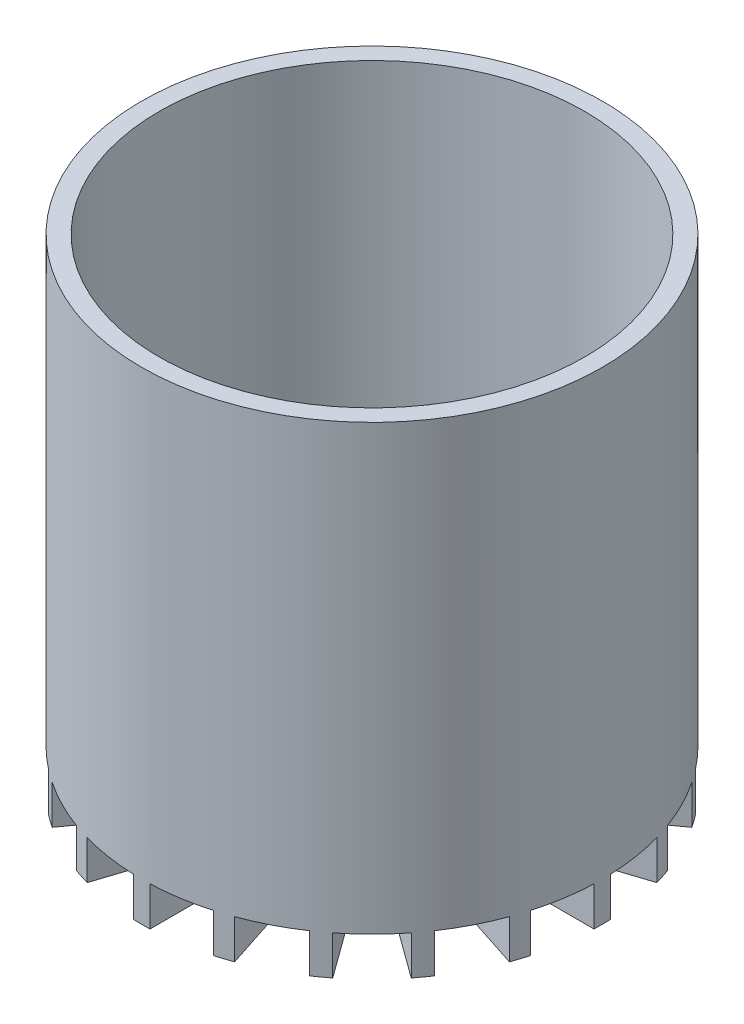
from build123d import *
from build123d.topology import SkipClean

# Parameters (mm, degrees)
SKETCH1_R               = 38.1
BOSS_EXTRUDE1_DEPTH     = 76.2
SHELL2_T                = 3.175
SKETCH2_W               = 3
SKETCH2_H               = 82.55
SKETCH2_W_2             = 82.55
SKETCH2_H_2             = 3
BOSS_EXTRUDE2_DEPTH     = 7
CUT_EXTRUDE1_DEPTH      = 99.527366122
CUT_EXTRUDE1_DEPTH_BACK = 99.527366122
SKETCH3_R               = 61.906276858
SKETCH3_R_2             = 41.275
SKETCH4_R               = 20.64
CUT_EXTRUDE2_DEPTH      = 7
SCALE1_SCALE            = 0.615384615


with BuildPart() as part:
    # Sketch1 → Boss-Extrude1 (new body)
    with BuildSketch(Plane(origin=(0, 0, 0), x_dir=(1, 0, 0), z_dir=(0, 1, 0))):
        with Locations(Location((0, 0, 0), (0, 0, 90))):
            Circle(SKETCH1_R)
    extrude(amount=BOSS_EXTRUDE1_DEPTH)

    # Shell2
    shell2_openings = [part.faces().sort_by_distance(p)[0] for p in [
        (0, 76.2, 0),
    ]]
    offset(amount=SHELL2_T, openings=shell2_openings, kind=Kind.INTERSECTION)

    # Sketch2 → Boss-Extrude2 (add)
    with BuildSketch(Plane(origin=(0, -3.175, 0), x_dir=(-1, 0, 0), z_dir=(0, -1, 0))):
        Rectangle(SKETCH2_W, SKETCH2_H)
        Polygon((-23.047310797, -34.273854321), (25.47436178, 32.510498564), (23.047310797, 34.273854321), (-25.47436178, -32.510498564), align=None)
        Polygon((-38.791332219, -14.181261217), (39.718383202, 11.328091668), (38.791332219, 14.181261217), (-39.718383202, -11.328091668), align=None)
        Polygon((-39.718383202, 11.328091668), (38.791332219, -14.181261217), (39.718383202, -11.328091668), (-38.791332219, 14.181261217), align=None)
        Polygon((-25.47436178, 32.510498564), (23.047310797, -34.273854321), (25.47436178, -32.510498564), (-23.047310797, 34.273854321), align=None)
        Polygon((-14.181261217, 38.791332219), (11.328091668, -39.718383202), (14.181261217, -38.791332219), (-11.328091668, 39.718383202), align=None)
        Polygon((11.328091668, 39.718383202), (-14.181261217, -38.791332219), (-11.328091668, -39.718383202), (14.181261217, 38.791332219), align=None)
        Polygon((32.510498564, 25.47436178), (-34.273854321, -23.047310797), (-32.510498564, -25.47436178), (34.273854321, 23.047310797), align=None)
        Rectangle(SKETCH2_W_2, SKETCH2_H_2)
        Polygon((-34.273854321, 23.047310797), (32.510498564, -25.47436178), (34.273854321, -23.047310797), (-32.510498564, 25.47436178), align=None)
    extrude(amount=BOSS_EXTRUDE2_DEPTH)

    # Sketch3 → Cut-Extrude1 (cut, two sides: drawn at the far end of the back side and taken through both)
    with SkipClean():  # the faces are left unmerged after this step: merging them gives an invalid solid
        with BuildSketch(Plane.XZ.offset(3.175).offset(-CUT_EXTRUDE1_DEPTH_BACK)):
            Circle(SKETCH3_R)
            with Locations(Location((0, 0, 0), (0, 0, 272.082679548))):
                Circle(SKETCH3_R_2, mode=Mode.SUBTRACT)
        extrude(amount=CUT_EXTRUDE1_DEPTH + CUT_EXTRUDE1_DEPTH_BACK, mode=Mode.SUBTRACT)

    # Sketch4 → Cut-Extrude2 (cut)
    with SkipClean():  # the faces are left unmerged after this step: merging them gives an invalid solid
        with BuildSketch(Plane.XZ.offset(10.175)):
            Circle(SKETCH4_R)
        extrude(amount=-CUT_EXTRUDE2_DEPTH, mode=Mode.SUBTRACT)


with BuildPart() as part_1:
    # Scale1: scaled about (0, 25.742888467, 0)
    add(part.part.scale(SCALE1_SCALE).moved(Location((0, 9.901110949, 0))))


solid = part_1.part
